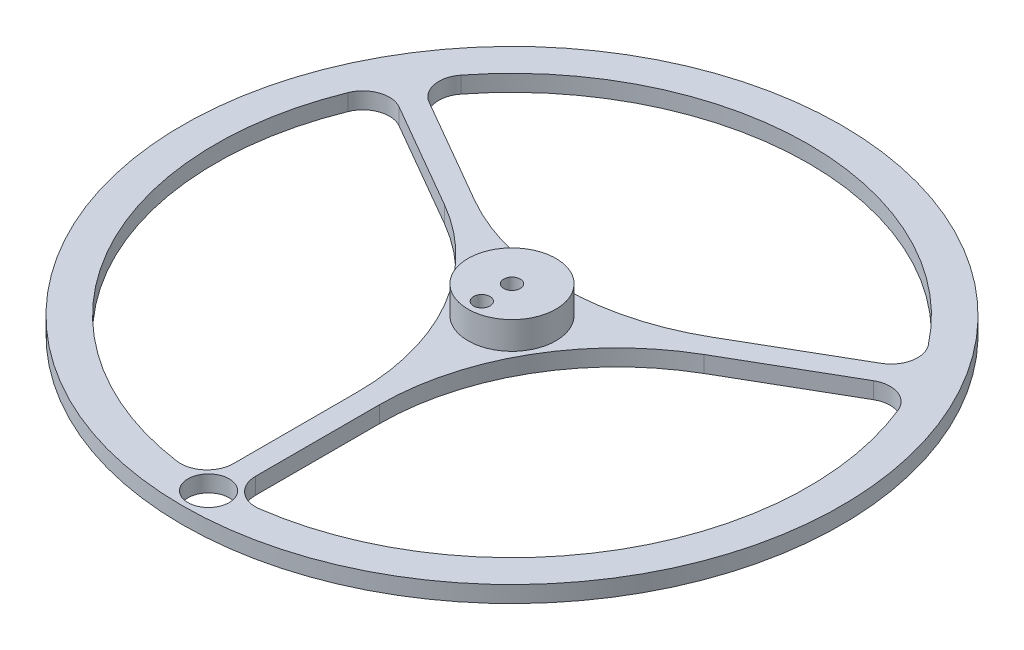
from build123d import *

# Parameters (mm, degrees)
SKETCH1_R           = 60
SKETCH1_R_2         = 54
SKETCH1_R_3         = 8
BOSS_EXTRUDE1_DEPTH = 3
SKETCH1_3_R         = 8
BOSS_EXTRUDE2_DEPTH = 5
CUT_EXTRUDE1_REACH  = 87.229
SKETCH2_R           = 1.5
CUT_EXTRUDE2_REACH  = 87
SKETCH3_R           = 3.75
SKETCH4_R           = 1.5
CUT_EXTRUDE3_DEPTH  = 5


with BuildPart() as part:
    # Sketch1 → Boss-Extrude1 (new body)
    # profile 1 of 3: a face of its own
    with BuildSketch(Plane(origin=(0, 0, 0), x_dir=(1, 0, 0), z_dir=(0, 1, 0))):
        with Locations(Location((0, 0, 0), (0, 0, 270))):
            Circle(SKETCH1_R)
        Circle(SKETCH1_R_2, mode=Mode.SUBTRACT)
    # profile 2 of 3: a face of its own
    with BuildSketch(Plane(origin=(0, 0, 0), x_dir=(1, 0, 0), z_dir=(0, 1, 0))):
        with BuildLine():
            ThreePointArc((7.5, -53.47663041), (3.660460389, -52.338407931), (2.000000204, -48.694167705))
            Line((2.000000204, -48.694167705), (2.000000204, -26.12435489))
            ThreePointArc((2.000000204, -26.12435489), (3.473664254, -14.930765123), (7.794228634, -4.5))
            ThreePointArc((7.794228634, -4.5), (14.667254021, 4.457101073), (23.624355095, 11.33012646))
            Line((23.624355095, 11.33012646), (43.170386351, 22.615032868))
            ThreePointArc((43.170386351, 22.615032868), (47.156621056, 22.999152279), (50.062120444, 20.243124677))
            ThreePointArc((50.062120444, 20.243124677), (46.765371804, 27), (42.562120444, 33.233505733))
            ThreePointArc((42.562120444, 33.233505733), (43.496160667, 29.339255651), (41.170386147, 26.079134837))
            Line((41.170386147, 26.079134837), (21.62435489, 14.79422843))
            ThreePointArc((21.62435489, 14.79422843), (11.193589767, 10.47366405), (0, 9))
            ThreePointArc((0, 9), (-11.193589767, 10.47366405), (-21.62435489, 14.79422843))
            Line((-21.62435489, 14.79422843), (-41.170386147, 26.079134837))
            ThreePointArc((-41.170386147, 26.079134837), (-43.496160667, 29.339255651), (-42.562120444, 33.233505733))
            ThreePointArc((-42.562120444, 33.233505733), (-46.765371804, 27), (-50.062120444, 20.243124677))
            ThreePointArc((-50.062120444, 20.243124677), (-47.156621056, 22.999152279), (-43.170386351, 22.615032868))
            Line((-43.170386351, 22.615032868), (-23.624355095, 11.33012646))
            ThreePointArc((-23.624355095, 11.33012646), (-14.667254021, 4.457101073), (-7.794228634, -4.5))
            ThreePointArc((-7.794228634, -4.5), (-3.473664254, -14.930765123), (-2.000000204, -26.12435489))
            Line((-2.000000204, -26.12435489), (-2.000000204, -48.694167705))
            ThreePointArc((-2.000000204, -48.694167705), (-3.660460389, -52.338407931), (-7.5, -53.47663041))
            ThreePointArc((-7.5, -53.47663041), (0, -54), (7.5, -53.47663041))
        make_face()
        Circle(SKETCH1_R_3, mode=Mode.SUBTRACT)
    # profile 3 of 3: a face of its own
    with BuildSketch(Plane(origin=(0, 0, 0), x_dir=(1, 0, 0), z_dir=(0, 1, 0))):
        Circle(SKETCH1_R_3)
    extrude(amount=-BOSS_EXTRUDE1_DEPTH)

    # Sketch1<3> → Boss-Extrude2 (add)
    with BuildSketch(Plane(origin=(0, 0, 0), x_dir=(1, 0, 0), z_dir=(0, 1, 0))):
        with Locations(Location((0, 0, 0), (0, 0, 270))):
            Circle(SKETCH1_3_R)
    extrude(amount=BOSS_EXTRUDE2_DEPTH)

    # Sketch2 → Cut-Extrude1 (cut, up to next)
    with BuildSketch(Plane(origin=(0, 5, 0), x_dir=(1, 0, 0), z_dir=(0, 1, 0)), mode=Mode.PRIVATE) as cut_extrude1_sk1:
        with Locations(Location((0, 0, 0), (0, 0, 270))):
            Circle(SKETCH2_R)
    cut_extrude1_tool1 = extrude(cut_extrude1_sk1.sketch, amount=-CUT_EXTRUDE1_REACH, mode=Mode.PRIVATE) & part.part
    add(cut_extrude1_tool1.solids().sort_by_distance((0, 5, 0))[0], mode=Mode.SUBTRACT)

    # Sketch3 → Cut-Extrude2 (cut, up to next)
    with BuildSketch(Plane(origin=(0, 0, 0), x_dir=(1, 0, 0), z_dir=(0, 1, 0)), mode=Mode.PRIVATE) as cut_extrude2_sk1:
        with Locations(Location((0, -55.25, 0), (0, 0, 270))):
            Circle(SKETCH3_R)
    cut_extrude2_tool1 = extrude(cut_extrude2_sk1.sketch, amount=-CUT_EXTRUDE2_REACH, mode=Mode.PRIVATE) & part.part
    add(cut_extrude2_tool1.solids().sort_by_distance((0, 0, 55.25))[0], mode=Mode.SUBTRACT)

    # Sketch4 → Cut-Extrude3 (cut)
    with BuildSketch(Plane(origin=(0, 5, 0), x_dir=(1, 0, 0), z_dir=(0, 1, 0))):
        with Locations(Location((0, -5.5, 0), (0, 0, 270))):
            Circle(SKETCH4_R)
    extrude(amount=-CUT_EXTRUDE3_DEPTH, mode=Mode.SUBTRACT)


solid = part.part
